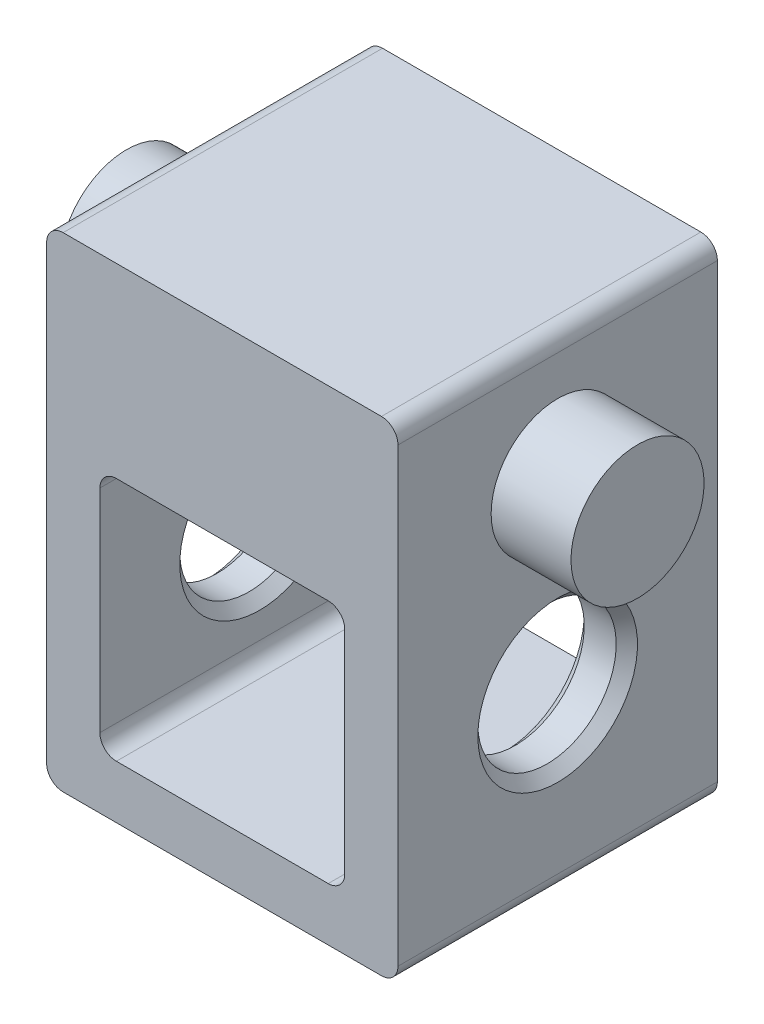
from build123d import *

# Parameters (mm, degrees)
SKETCH1_W                = 66
SKETCH1_H                = 66
BOSS_EXTRUDE1_DEPTH      = 60
SHELL1_T                 = -10
FILLET2_R                = 3.1
SKETCH2_W                = 60
SKETCH2_H                = 25
BOSS_EXTRUDE2_DEPTH      = 66
FILLET3_R                = 3.1
BOSS_EXTRUDE4_DEPTH      = 48
BOSS_EXTRUDE4_DEPTH_BACK = 48
SKETCH3_R                = 12.5
CUT_EXTRUDE1_DEPTH       = 110.567330952
CUT_EXTRUDE1_DEPTH_BACK  = 110.567330952
SKETCH4_R                = 13
CHAMFER1_SIZE            = 2


with BuildPart() as part:
    # Sketch1 → Boss-Extrude1 (new body)
    with BuildSketch(Plane.XY):
        Rectangle(SKETCH1_W, SKETCH1_H)
    extrude(amount=BOSS_EXTRUDE1_DEPTH)

    # Shell1
    shell1_openings = [part.faces().sort_by_distance(p)[0] for p in [
        (0, 0, 60),
        (0, 0, 0),
    ]]
    offset(amount=SHELL1_T, openings=shell1_openings, kind=Kind.INTERSECTION)

    # Fillet2
    fillet2_edges = [part.edges().sort_by_distance(p)[0] for p in [
        (23, -23, 30),
        (23, 23, 30),
        (-23, 23, 30),
        (-23, -23, 30),
    ]]
    fillet(fillet2_edges, radius=FILLET2_R)

    # Sketch2 → Boss-Extrude2 (add)
    with BuildSketch(Plane(origin=(33, 0, 0), x_dir=(0, 0, -1), z_dir=(1, 0, 0))):
        with Locations((-30, 45.5)):
            Rectangle(SKETCH2_W, SKETCH2_H)
    extrude(amount=-BOSS_EXTRUDE2_DEPTH)

    # Fillet3
    fillet3_edges = [part.edges().sort_by_distance(p)[0] for p in [
        (33, 58, 30),
        (-33, 58, 30),
        (33, -33, 30),
        (-33, -33, 30),
    ]]
    fillet(fillet3_edges, radius=FILLET3_R)

    # Sketch3 → Boss-Extrude4 (add, two sides: drawn at the far end of the back side and taken through both)
    with BuildSketch(Plane(origin=(0, 0, 0), x_dir=(0, 0, -1), z_dir=(1, 0, 0)).offset(-BOSS_EXTRUDE4_DEPTH_BACK)):
        with Locations((-30, 34.952906867)):
            Circle(SKETCH3_R)
    extrude(amount=BOSS_EXTRUDE4_DEPTH + BOSS_EXTRUDE4_DEPTH_BACK)

    # Sketch4 → Cut-Extrude1 (cut, two sides: drawn at the far end of the back side and taken through both)
    with BuildSketch(Plane.ZY.offset(-23).offset(-CUT_EXTRUDE1_DEPTH_BACK)):
        with Locations(Location((30, 0, 0), (0, 0, 180))):
            Circle(SKETCH4_R)
    extrude(amount=CUT_EXTRUDE1_DEPTH + CUT_EXTRUDE1_DEPTH_BACK, mode=Mode.SUBTRACT)

    # Chamfer1
    chamfer1_edges = [part.edges().sort_by_distance(p)[0] for p in [
        (33, 0, 43),
        (-33, 0, 43),
        (-23, 0, 43),
        (23, 0, 43),
    ]]
    chamfer(chamfer1_edges, length=CHAMFER1_SIZE)


solid = part.part
